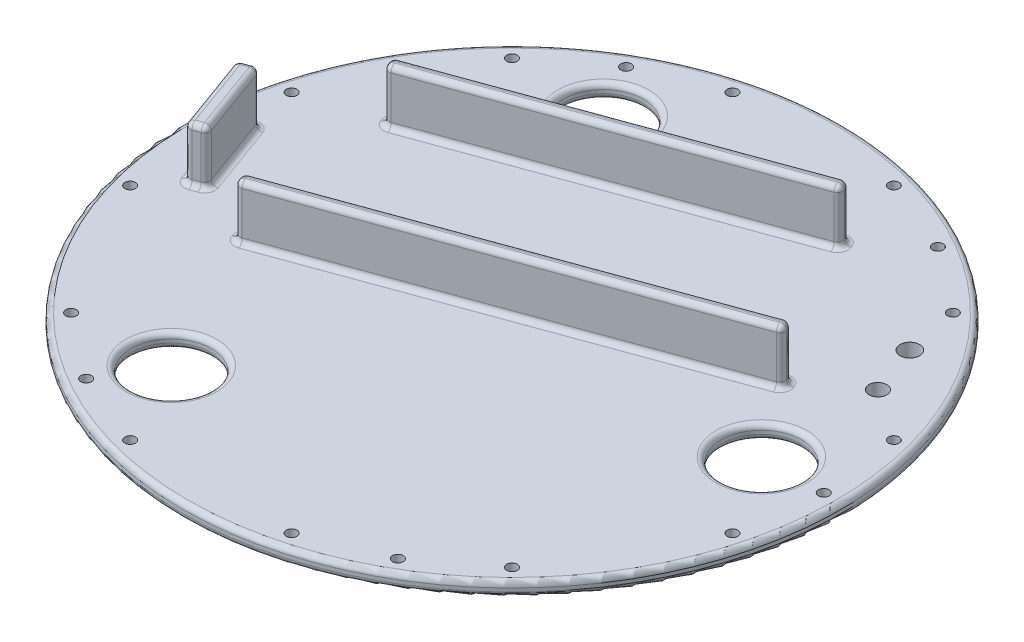
from build123d import *

# Parameters (mm, degrees)
SKETCH1_R           = 92.49999999999999
BOSS_EXTRUDE1_DEPTH = 4
SKETCH2_R           = 11.25
SKETCH2_R_2         = 1.5000000000000249
SKETCH2_R_3         = 1.499999999995183
SKETCH2_R_4         = 1.4999999999965499
SKETCH2_R_5         = 1.5000000000042735
SKETCH2_R_6         = 1.4999999999999871
SKETCH2_R_7         = 1.5000000000000453
SKETCH2_R_8         = 1.500000000007309
SKETCH2_R_9         = 1.5000000000031166
SKETCH2_R_10        = 1.5000000000027374
SKETCH2_R_11        = 11.249999999999991
SKETCH2_R_12        = 1.5000000000078528
SKETCH2_R_13        = 1.5000000000045326
SKETCH2_R_14        = 1.500000000002343
SKETCH2_R_15        = 1.500000000005574
SKETCH2_R_16        = 1.5000000000030589
SKETCH2_R_17        = 1.499999999999451
SKETCH2_R_18        = 1.5000000000021194
SKETCH2_R_19        = 1.4999999999995053
SKETCH2_R_20        = 1.4999999999963318
CUT_EXTRUDE1_DEPTH  = 131.87589541240968
FILLET1_R           = 1.5
BOSS_EXTRUDE2_DEPTH = 15
SKETCH4_R           = 2.750000000000009
SKETCH4_R_2         = 2.499999999999997
CUT_EXTRUDE2_DEPTH  = 10
FILLET2_R           = 1.5


with BuildPart() as part:
    # Sketch1 → Boss-Extrude1 (new body)
    with BuildSketch(Plane(origin=(0, 0, 0), x_dir=(1, 0, 0), z_dir=(0, 1, 0))):
        Circle(SKETCH1_R)
    extrude(amount=BOSS_EXTRUDE1_DEPTH)

    # Sketch2 → Cut-Extrude1 (cut, through all)
    with BuildSketch(Plane(origin=(0, 4, 0), x_dir=(1, 0, 0), z_dir=(0, 1, 0))):
        with Locations((-35.00000000000031, 60.62177826491053)):
            Circle(SKETCH2_R)
        with Locations((-43.750000000000405, 75.7772228311382)):
            Circle(SKETCH2_R_2)
        with Locations((-22.64666644646606, 84.5185098002921)):
            Circle(SKETCH2_R_3)
        with Locations((-61.87184335381868, 61.871843353821774)):
            Circle(SKETCH2_R_4)
        with Locations((43.74999999999966, 75.77722283114234)):
            Circle(SKETCH2_R_5)
        with Locations((22.646666446471723, 84.51850980029295)):
            Circle(SKETCH2_R_6)
        with Locations((61.87184335382398, 61.871843353822015)):
            Circle(SKETCH2_R_7)
        with Locations((87.50000000000331, 5.98713e-12)):
            Circle(SKETCH2_R_8)
        with Locations((84.51850980029364, 22.646666446473013)):
            Circle(SKETCH2_R_9)
        with Locations((84.51850980029329, -22.646666446468245)):
            Circle(SKETCH2_R_10)
        with Locations((70, 3.786e-13)):
            Circle(SKETCH2_R_11)
        with Locations((-34.9999999999997, -60.62177826491089)):
            Circle(SKETCH2_R)
        with Locations((43.75000000000686, -75.77722283113455)):
            Circle(SKETCH2_R_12)
        with Locations((61.871843353825135, -61.87184335381813)):
            Circle(SKETCH2_R_13)
        with Locations((22.646666446472512, -84.51850980028846)):
            Circle(SKETCH2_R_14)
        with Locations((-43.74999999999319, -75.77722283113872)):
            Circle(SKETCH2_R_15)
        with Locations((-22.646666446465257, -84.51850980028934)):
            Circle(SKETCH2_R_16)
        with Locations((-61.87184335381753, -61.871843353818406)):
            Circle(SKETCH2_R_17)
        with Locations((-87.49999999999687, -2.31772e-12)):
            Circle(SKETCH2_R_18)
        with Locations((-84.5185098002872, -22.646666446469347)):
            Circle(SKETCH2_R_19)
        with Locations((-84.51850980028684, 22.646666446471897)):
            Circle(SKETCH2_R_20)
    extrude(amount=-CUT_EXTRUDE1_DEPTH, mode=Mode.SUBTRACT)

    # Fillet1
    fillet1_edges = [part.edges().sort_by_distance(p)[0] for p in [
        (-92.49999999999999, 4, 2.975e-14),
        (-92.49999999999999, 0, 2.975e-14),
        (58.75000000000001, 4, -3.7998e-13),
        (58.75000000000001, 0, -3.7998e-13),
        (-46.25000000000031, 4, -60.62177826491053),
        (-46.25000000000031, 0, -60.62177826491053),
        (-46.2499999999997, 4, 60.62177826491089),
        (-46.2499999999997, 0, 60.62177826491089),
    ]]
    fillet(fillet1_edges, radius=FILLET1_R)

    # Sketch3 → Boss-Extrude2 (add)
    with BuildSketch(Plane(origin=(0, 4, 0), x_dir=(1, 0, 0), z_dir=(0, 1, 0))):
        Polygon((-72.48847183437992, -12.815379476090778), (-76.5927135542881, -1.539068026660118), (-80.69695527419628, 9.737243422770598), (-85.39541837812693, 8.02714270614176), (-77.18693493831057, -14.525480192719614), align=None)
        Polygon((-63.14508281143372, 27.29946916585036), (-16.16045177213818, 44.400476332134), (30.824179267157554, 61.501483498417706), (29.62710876551767, 64.79040767116848), (-64.34215331307357, 30.588393338601033), align=None)
        Polygon((-57.151102569636805, -18.40690020277215), (-55.95403206799694, -21.695824375522825), (56.809082426311754, 19.346592823558282), (55.612011924671876, 22.635516996308972), align=None)
    extrude(amount=BOSS_EXTRUDE2_DEPTH)

    # Sketch4 → Cut-Extrude2 (cut)
    with BuildSketch(Plane(origin=(0, 4, 0), x_dir=(1, 0, 0), z_dir=(0, 1, 0))):
        with Locations((64.92060879565776, 46.747348091642216)):
            Circle(SKETCH4_R)
        with Locations((70.05091094554284, 32.65195877985365)):
            Circle(SKETCH4_R_2)
    extrude(amount=-CUT_EXTRUDE2_DEPTH, mode=Mode.SUBTRACT)

    # Fillet2
    fillet2_edges = [part.edges().sort_by_distance(p)[0] for p in [
        (0.4275251791574064, 4, 1.1746157759822715),
        (56.21054717549181, 4, -20.991054909933627),
        (-0.7695453224824647, 4, -2.1143083967684113),
        (-56.55256731881687, 4, 20.051362289147487),
        (-74.83770338634525, 4, 13.670429834405196),
        (-76.59271355428811, 4, 1.5390680266600896),
        (-83.0461868261616, 4, -8.882193064456178),
        (-81.29117665821875, 4, 3.2491687432889282),
        (-16.16045177213808, 4, -44.40047633213403),
        (30.225644016337608, 4, -63.1459455847931),
        (-63.743618062253645, 4, -28.943931252225696),
        (-17.357522273777946, 4, -47.68940050488476),
        (0.4275251791574064, 19, 1.1746157759822715),
        (56.21054717549181, 19, -20.991054909933627),
        (-0.7695453224824647, 19, -2.1143083967684113),
        (-55.95403206799694, 11.5, 21.695824375522825),
        (-57.151102569636805, 11.5, 18.40690020277215),
        (55.612011924671876, 11.5, -22.635516996308972),
        (56.809082426311754, 11.5, -19.346592823558282),
        (-77.18693493831057, 11.5, 14.525480192719614),
        (-85.39541837812693, 11.5, -8.02714270614176),
        (-80.69695527419628, 11.5, -9.737243422770598),
        (-72.48847183437992, 11.5, 12.815379476090778),
        (-63.743618062253645, 19, -28.943931252225696),
        (-16.160451772138085, 19, -44.40047633213403),
        (30.225644016337608, 19, -63.1459455847931),
        (-17.357522273777946, 19, -47.68940050488476),
        (-64.34215331307357, 11.5, -30.588393338601033),
        (29.627108765517672, 11.5, -64.79040767116848),
        (30.82417926715755, 11.5, -61.501483498417706),
        (-63.14508281143372, 11.5, -27.29946916585036),
        (-56.55256731881687, 19, 20.051362289147487),
        (-83.0461868261616, 19, -8.882193064456178),
        (-74.83770338634525, 19, 13.670429834405196),
        (-76.59271355428811, 19, 1.5390680266600896),
        (-81.29117665821875, 19, 3.2491687432889282),
    ]]
    fillet(fillet2_edges, radius=FILLET2_R)


solid = part.part
